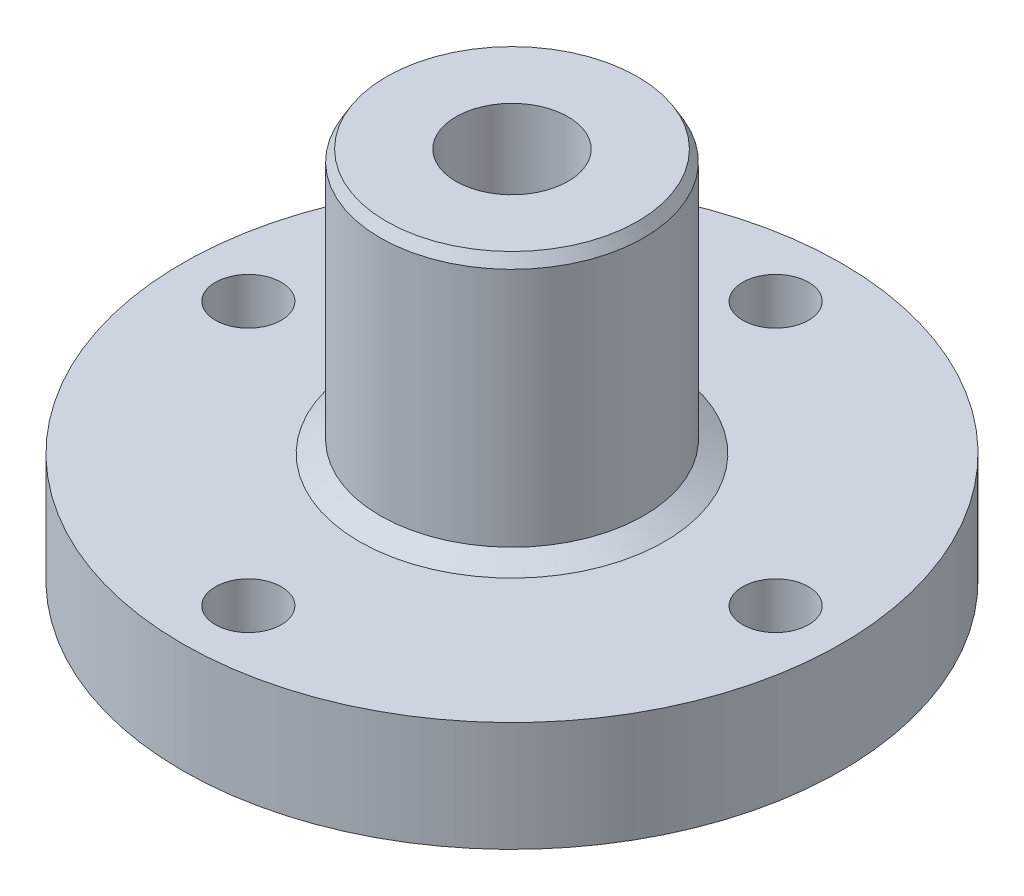
from build123d import *

# Parameters (mm, degrees)
SKETCH_1_R          = 15
EXTRUDE_1_DEPTH     = 5
SKETCH_4_R          = 6
EXTRUDE_2_DEPTH     = 12
SKETCH_5_R          = 2.55
CUT_EXTRUDE_1_DEPTH = 28.184554438
SKETCH_6_W          = 4
SKETCH_6_H          = 3
CUT_EXTRUDE_2_DEPTH = 28.184554438
CHAMFER_1_SIZE      = 0.947
CHAMFER_1_SIZE2     = 0.546750705
CHAMFER_2_SIZE      = 0.5
CHAMFER_2_SIZE2     = 0.288675135
SKETCH_7_R          = 1.5
CUT_EXTRUDE_3_DEPTH = 25.372115214


with BuildPart() as part:
    # 草图1 → 凸台-拉伸1 (new body)
    with BuildSketch(Plane(origin=(0, 0, 0), x_dir=(1, 0, 0), z_dir=(0, 1, 0))):
        with Locations(Location((0, 0, 0), (0, 0, 270))):
            Circle(SKETCH_1_R)
    extrude(amount=EXTRUDE_1_DEPTH)

    # 草图4 → 凸台-拉伸2 (add)
    with BuildSketch(Plane(origin=(0, 5, 0), x_dir=(1, 0, 0), z_dir=(0, 1, 0))):
        with Locations(Location((0, 0, 0), (0, 0, 270))):
            Circle(SKETCH_4_R)
    extrude(amount=EXTRUDE_2_DEPTH)

    # 草图5 → 切除-拉伸1 (cut, through all)
    with BuildSketch(Plane(origin=(0, 17, 0), x_dir=(1, 0, 0), z_dir=(0, 1, 0))):
        with Locations(Location((0, 0, 0), (0, 0, 270))):
            Circle(SKETCH_5_R)
    extrude(amount=-CUT_EXTRUDE_1_DEPTH, mode=Mode.SUBTRACT)

    # 草图6 → 切除-拉伸2 (cut, through all)
    with BuildSketch(Plane.XY):
        with Locations((0, 11.5)):
            Rectangle(SKETCH_6_W, SKETCH_6_H)
    extrude(amount=-CUT_EXTRUDE_2_DEPTH, mode=Mode.SUBTRACT)

    # 倒角1
    chamfer_1_edges = [part.edges().sort_by_distance(p)[0] for p in [
        (0, 5, -6),
    ]]
    chamfer_1_side = [part.faces().sort_by_distance(p)[0] for p in [
        (0, 5, -14.575735931),
    ]]
    chamfer(chamfer_1_edges, length=CHAMFER_1_SIZE, length2=CHAMFER_1_SIZE2, reference=chamfer_1_side[0])

    # 倒角2
    chamfer_2_edges = [part.edges().sort_by_distance(p)[0] for p in [
        (0, 17, -6),
    ]]
    chamfer_2_side = [part.faces().sort_by_distance(p)[0] for p in [
        (0, 11.273375352, -6),
    ]]
    chamfer(chamfer_2_edges, length=CHAMFER_2_SIZE, length2=CHAMFER_2_SIZE2, reference=chamfer_2_side[0])

    # 草图7 → 切除-拉伸3 (cut, through all)
    with BuildSketch(Plane(origin=(0, 5, 0), x_dir=(1, 0, 0), z_dir=(0, 1, 0))):
        with Locations(Location((0, 12, 0), (0, 0, 270))):
            Circle(SKETCH_7_R)
        with Locations(Location((-12, 0, 0), (0, 0, 270))):
            Circle(SKETCH_7_R)
        with Locations(Location((12, 0, 0), (0, 0, 270))):
            Circle(SKETCH_7_R)
        with Locations(Location((0, -12, 0), (0, 0, 270))):
            Circle(SKETCH_7_R)
    extrude(amount=-CUT_EXTRUDE_3_DEPTH, mode=Mode.SUBTRACT)


solid = part.part
